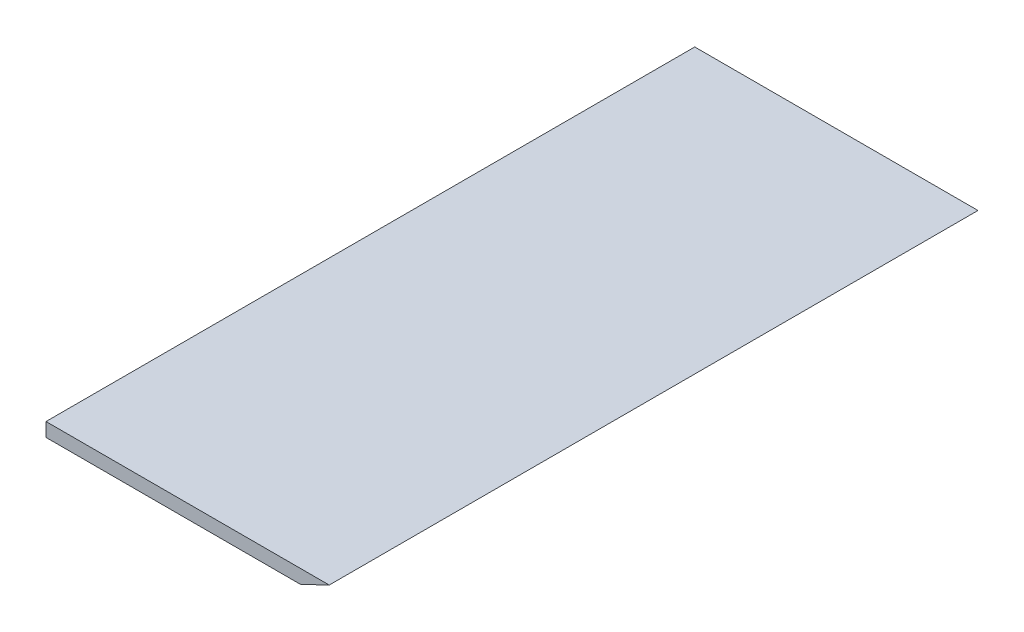
from build123d import *

# Parameters (mm, degrees)
BOSS_EXTRUDE2_DEPTH = 298.45


with BuildPart() as part:
    # Sketch1 → Boss-Extrude2 (new body)
    with BuildSketch(Plane.XY):
        Polygon((0, 0), (117.094, 0), (130.302, 6.35), (0, 6.35), align=None)
    extrude(amount=BOSS_EXTRUDE2_DEPTH)


solid = part.part
